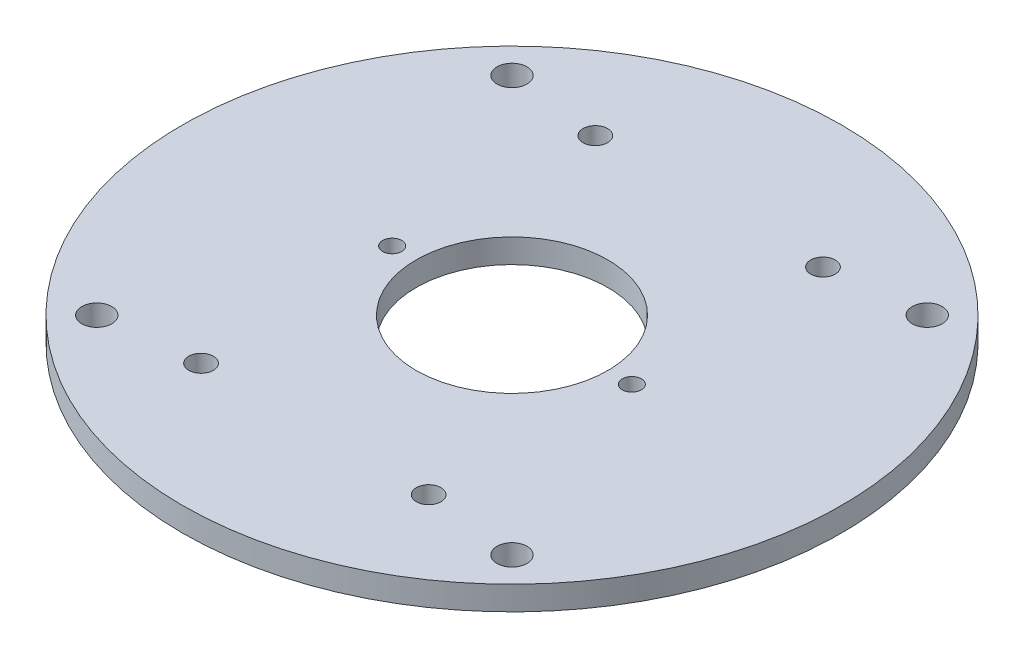
from build123d import *

# Parameters (mm, degrees)
SKETCH_1_R           = 27.5
EXTRUDE_1_DEPTH      = 2
SKETCH_2_R           = 8
CUT_EXTRUDE_1_DEPTH  = 39.942264957
HOLE_WIZARD_M2_1_D   = 1.6
HOLE_WIZARD_M3_4_D   = 2.5
MIRROR_2_COPY_1_D    = 2.5
HOLE_WIZARD_M2_5_1_D = 2.05


with BuildPart() as part:
    # 草图1 → 凸台-拉伸1 (new body)
    with BuildSketch(Plane(origin=(0, 0, 0), x_dir=(1, 0, 0), z_dir=(0, 1, 0))):
        with Locations(Location((0, 0, 0), (0, 0, 270))):
            Circle(SKETCH_1_R)
    extrude(amount=EXTRUDE_1_DEPTH)

    # 草图2 → 切除-拉伸1 (cut, through all)
    with BuildSketch(Plane(origin=(0, 2, 0), x_dir=(1, 0, 0), z_dir=(0, 1, 0))):
        with Locations(Location((0, 0, 0), (0, 0, 270))):
            Circle(SKETCH_2_R)
    extrude(amount=-CUT_EXTRUDE_1_DEPTH, mode=Mode.SUBTRACT)

    # M2 螺纹孔1 (through all)
    with Locations(Plane(origin=(0, 2, 0), x_dir=(1, 0, 0), z_dir=(0, 1, 0))):
        with Locations((-10, 0)):
            hole_wizard_m2_1 = Hole(HOLE_WIZARD_M2_1_D / 2)

    # M3 螺纹孔4 (through all)
    with Locations(Plane(origin=(0, 2, 0), x_dir=(1, 0, 0), z_dir=(0, 1, 0))):
        with Locations((-17.324116139, 17.324116139)):
            hole_wizard_m3_4 = Hole(HOLE_WIZARD_M3_4_D / 2)

    # 镜向1: M3 螺纹孔4 across plane
    add(hole_wizard_m3_4.mirror(Plane(origin=(0, 0, 0), x_dir=(0, 0, 1), z_dir=(1, 0, 0))), mode=Mode.SUBTRACT)

    # 镜向2: M3 螺纹孔4 across plane
    add(hole_wizard_m3_4.mirror(Plane.XY), mode=Mode.SUBTRACT)

    # 镜向2 copy 1 (through all)
    with Locations(Plane(origin=(0, 2, 0), x_dir=(-1, 0, 0), z_dir=(0, 1, 0))):
        with Locations((-17.324116139, 17.324116139)):
            Hole(MIRROR_2_COPY_1_D / 2)

    # 镜向3: M2 螺纹孔1 across plane
    add(hole_wizard_m2_1.mirror(Plane(origin=(0, 0, 0), x_dir=(0, 0, 1), z_dir=(1, 0, 0))), mode=Mode.SUBTRACT)

    # M2.5 螺纹孔1 (through all)
    with Locations(Plane(origin=(0, 2, 0), x_dir=(1, 0, 0), z_dir=(0, 1, 0))):
        with Locations((-9.497088469, 16.451681088), (9.497088469, 16.451681088)):
            hole_wizard_m2_5_1 = Hole(HOLE_WIZARD_M2_5_1_D / 2)

    # 镜向4: M2.5 螺纹孔1 across plane
    add(hole_wizard_m2_5_1.mirror(Plane.XY), mode=Mode.SUBTRACT)


solid = part.part
